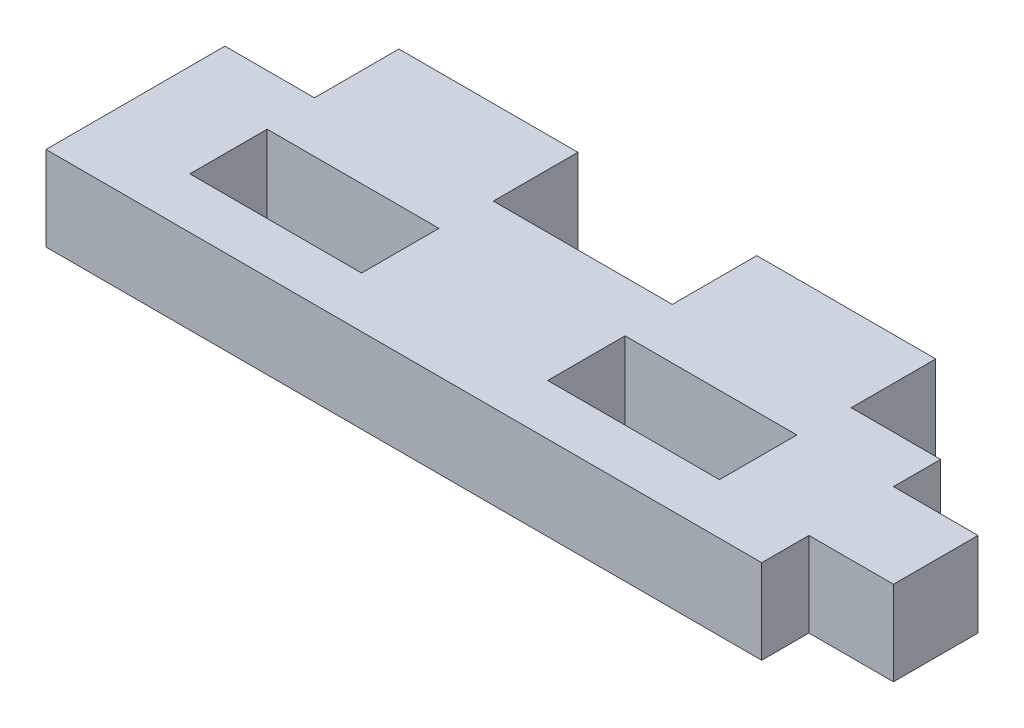
from build123d import *

# Parameters (mm, degrees)
SKETCH1_W           = 6.096
SKETCH1_H           = 2.745994
BOSS_EXTRUDE1_DEPTH = 1.5


with BuildPart() as part:
    # Sketch1 → Boss-Extrude1 (new, symmetric)
    with BuildSketch(Plane(origin=(0, 0, 0), x_dir=(1, 0, 0), z_dir=(0, 1, 0))):
        Polygon((3.175, 3.175), (6.35, 3.175), (6.35, 1.5), (9.35, 1.5), (9.35, -1.5), (6.35, -1.5), (6.35, -3.175), (-6.35, -3.175), (-19.05, -3.175), (-19.05, 3.175), (-15.875, 3.175), (-15.875, 6.175), (-9.525, 6.175), (-9.525, 3.175), (-6.35, 3.175), (-3.175, 3.175), (-3.175, 6.175), (3.175, 6.175), align=None)
        Rectangle(SKETCH1_W, SKETCH1_H, mode=Mode.SUBTRACT)
        with Locations((-12.7, 0)):
            Rectangle(SKETCH1_W, SKETCH1_H, mode=Mode.SUBTRACT)
    extrude(amount=BOSS_EXTRUDE1_DEPTH, both=True)


solid = part.part
